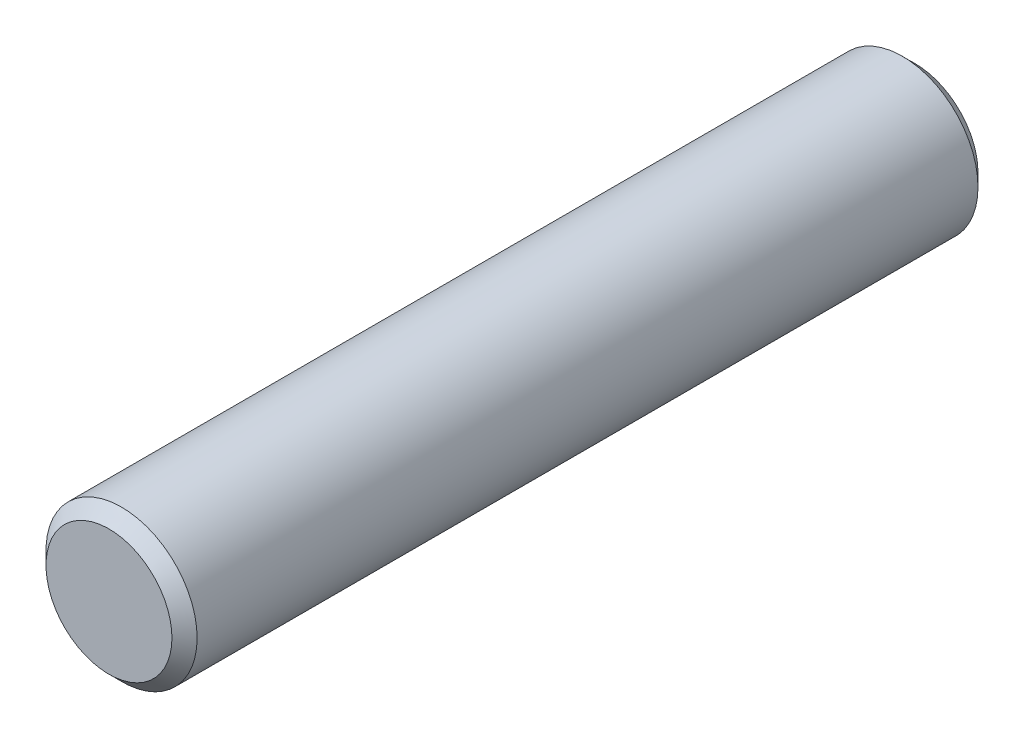
from build123d import *

# Parameters (mm, degrees)
SKETCH1_R           = 3
BOSS_EXTRUDE1_DEPTH = 32
CHAMFER1_SIZE       = 0.5


with BuildPart() as part:
    # Sketch1 → Boss-Extrude1 (new body)
    with BuildSketch(Plane.XY):
        Circle(SKETCH1_R)
    extrude(amount=BOSS_EXTRUDE1_DEPTH)

    # Chamfer1
    chamfer1_edges = [part.edges().sort_by_distance(p)[0] for p in [
        (-3, 0, 0),
        (-3, 0, 32),
    ]]
    chamfer(chamfer1_edges, length=CHAMFER1_SIZE)


solid = part.part
